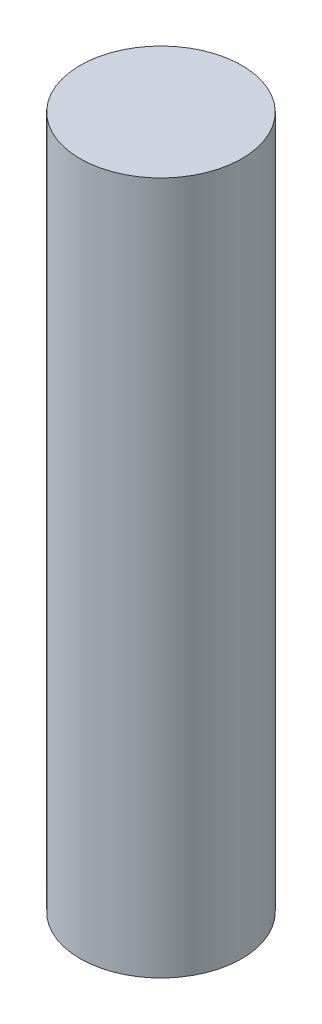
from build123d import *

# Parameters (mm, degrees)
SKETCH1_R           = 1.75
BOSS_EXTRUDE1_DEPTH = 15


with BuildPart() as part:
    # Sketch1 → Boss-Extrude1 (new body)
    with BuildSketch(Plane(origin=(0, 0, 0), x_dir=(1, 0, 0), z_dir=(0, 1, 0))):
        with Locations(Location((0, 0, 0), (0, 0, 270))):
            Circle(SKETCH1_R)
    extrude(amount=BOSS_EXTRUDE1_DEPTH)


solid = part.part
